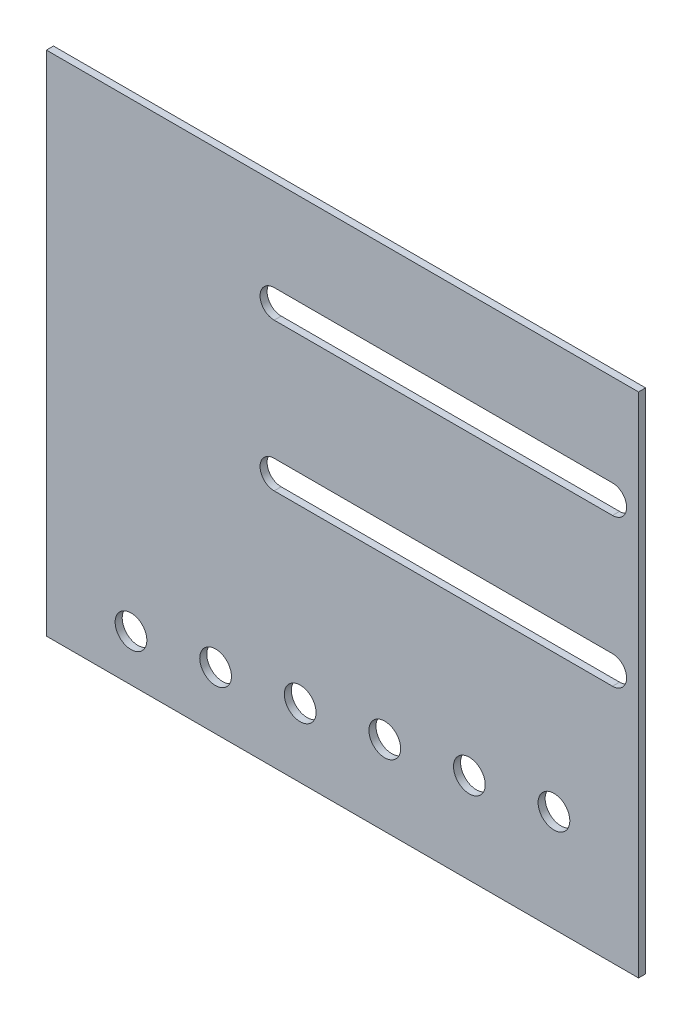
from build123d import *

# Parameters (mm, degrees)
SKETCH1_W           = 533.4
SKETCH1_H           = 457.2
BOSS_EXTRUDE4_DEPTH = 6.35
SKETCH3_R           = 14.2875
CUT_EXTRUDE2_DEPTH  = 12.7


with BuildPart() as part:
    # Sketch1 → Boss-Extrude4 (new body)
    with BuildSketch(Plane.XY):
        Rectangle(SKETCH1_W, SKETCH1_H)
        with BuildLine():
            Line((-61.54804751, 145.902211593), (243.25195249, 145.902211593))
            ThreePointArc((243.25195249, 145.902211593), (255.95195249, 133.202211593), (243.25195249, 120.502211593))
            Line((243.25195249, 120.502211593), (-61.54804751, 120.502211593))
            ThreePointArc((-61.54804751, 120.502211593), (-74.24804751, 133.202211593), (-61.54804751, 145.902211593))
        make_face(mode=Mode.SUBTRACT)
        with BuildLine():
            Line((-61.54804751, 12.7), (243.25195249, 12.7))
            ThreePointArc((243.25195249, 12.7), (255.95195249, 0), (243.25195249, -12.7))
            Line((243.25195249, -12.7), (-61.54804751, -12.7))
            ThreePointArc((-61.54804751, -12.7), (-74.24804751, 0), (-61.54804751, 12.7))
        make_face(mode=Mode.SUBTRACT)
    extrude(amount=BOSS_EXTRUDE4_DEPTH)

    # Sketch3 → Cut-Extrude2 (cut)
    with BuildSketch(Plane(origin=(0, 0, 0), x_dir=(-1, 0, 0), z_dir=(0, 0, -1))):
        with Locations((-190.5, -136.944186205)):
            Circle(SKETCH3_R)
        with Locations((-114.3, -146.88837241)):
            Circle(SKETCH3_R)
        with Locations((-38.1, -156.832558615)):
            Circle(SKETCH3_R)
        with Locations((38.1, -166.77674482)):
            Circle(SKETCH3_R)
        with Locations((114.3, -176.720931025)):
            Circle(SKETCH3_R)
        with Locations((190.5, -186.66511723)):
            Circle(SKETCH3_R)
    extrude(amount=-CUT_EXTRUDE2_DEPTH, mode=Mode.SUBTRACT)


solid = part.part
